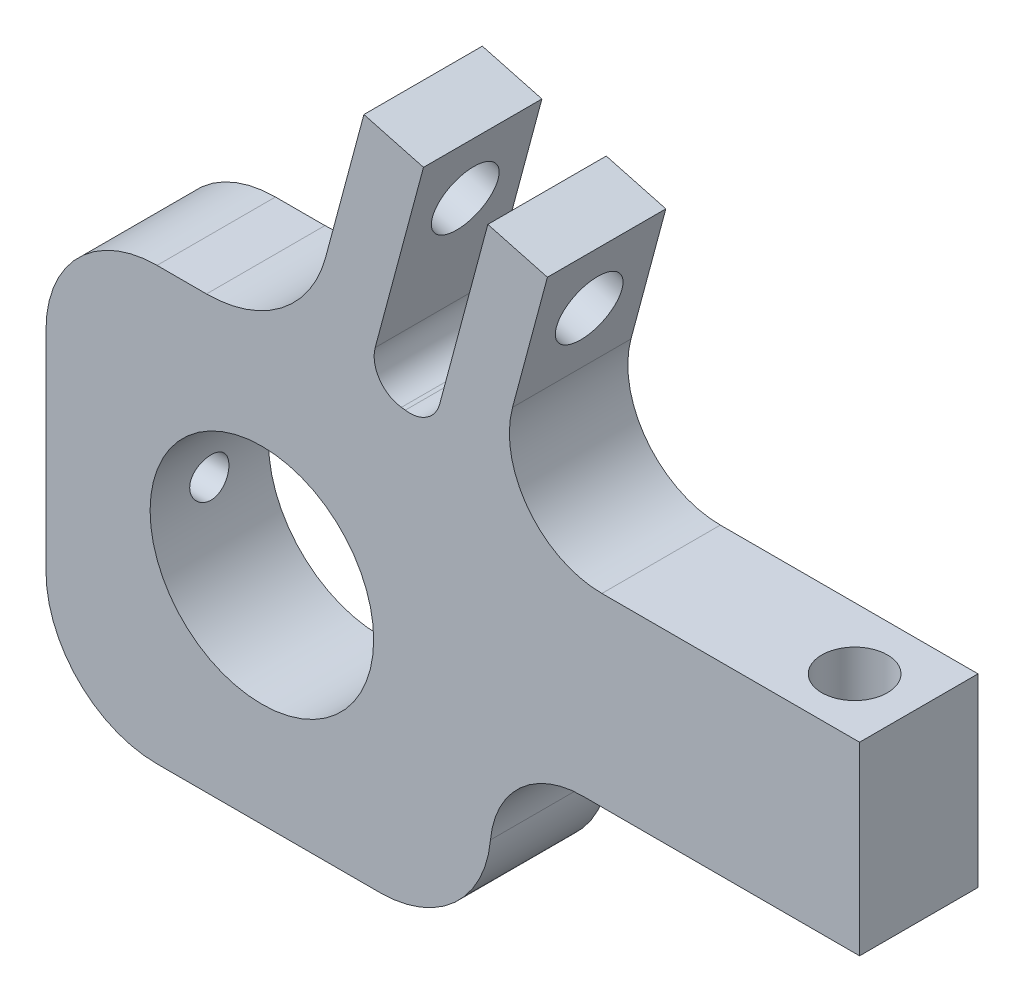
from build123d import *

# Parameters (mm, degrees)
SKETCH1_W                = 96.52
SKETCH1_H                = 44.45
BOSS_EXTRUDE1_DEPTH      = 6.096
CUT_EXTRUDE1_REACH       = 108.961
SKETCH2_R                = 11.50874
CUT_EXTRUDE2_REACH       = 108.438
SKETCH3_R                = 3.3782
CUT_EXTRUDE3_REACH       = 108.961
SKETCH7_W                = 12.7635
SKETCH7_H                = 12.192
CUT_EXTRUDE5_DEPTH       = 104.946532487
FILLET1_R                = 11.43
CUT_EXTRUDE9_REACH       = 97.016
CUT_EXTRUDE9_END_RADIUS  = 11.50874
SKETCH11_R               = 2.0193
BOSS_EXTRUDE2_DEPTH      = 6.096
FILLET2_R                = 3.175
FILLET3_R                = 12.7
FILLET4_R                = 9.525
CUT_EXTRUDE10_DEPTH      = 57.546170308
CUT_EXTRUDE10_DEPTH_BACK = 57.546170308
SKETCH15_R               = 3.3782


with BuildPart() as part:
    # Sketch1 → Boss-Extrude1 (new, symmetric)
    with BuildSketch(Plane.XY):
        with Locations((48.26, -22.225)):
            Rectangle(SKETCH1_W, SKETCH1_H)
    extrude(amount=BOSS_EXTRUDE1_DEPTH, both=True)

    # Sketch2 → Cut-Extrude1 (cut, up to next)
    with BuildSketch(Plane.XY.offset(6.096), mode=Mode.PRIVATE) as cut_extrude1_sk1:
        with Locations((22.225, -22.225)):
            Circle(SKETCH2_R)
    cut_extrude1_tool1 = extrude(cut_extrude1_sk1.sketch, amount=-CUT_EXTRUDE1_REACH, mode=Mode.PRIVATE) & part.part
    add(cut_extrude1_tool1.solids().sort_by_distance((22.225, -22.225, 6.096))[0], mode=Mode.SUBTRACT)

    # Sketch3 → Cut-Extrude2 (cut, up to next)
    with BuildSketch(Plane(origin=(0, 0, 0), x_dir=(1, 0, 0), z_dir=(0, 1, 0)), mode=Mode.PRIVATE) as cut_extrude2_sk1:
        with Locations(Location((77.4065, -0.254, 0), (0, 0, 270))):
            Circle(SKETCH3_R)
    cut_extrude2_tool1 = extrude(cut_extrude2_sk1.sketch, amount=-CUT_EXTRUDE2_REACH, mode=Mode.PRIVATE) & part.part
    add(cut_extrude2_tool1.solids().sort_by_distance((77.4065, 0, 0.254))[0], mode=Mode.SUBTRACT)

    # Sketch4 → Cut-Extrude3 (cut, up to next)
    with BuildSketch(Plane.XY.offset(6.096), mode=Mode.PRIVATE) as cut_extrude3_sk1:
        with BuildLine():
            Line((48.895, 6.35), (96.52, 6.35))
            ThreePointArc((96.52, 6.35), (102.87, 0), (96.52, -6.35))
            Line((96.52, -6.35), (48.895, -6.35))
            ThreePointArc((48.895, -6.35), (42.545, 0), (48.895, 6.35))
        make_face()
    cut_extrude3_tool1 = extrude(cut_extrude3_sk1.sketch, amount=-CUT_EXTRUDE3_REACH, mode=Mode.PRIVATE) & part.part
    # Sketch4 → Cut-Extrude3 (cut, up to next)
    with BuildSketch(Plane.XY.offset(6.096), mode=Mode.PRIVATE) as cut_extrude3_sk2:
        with BuildLine():
            Line((45.72, -34.925), (45.72, -44.45))
            Line((45.72, -44.45), (55.245, -44.45))
            Line((55.245, -44.45), (96.52, -44.45))
            ThreePointArc((96.52, -44.45), (106.045, -34.925), (96.52, -25.4))
            Line((96.52, -25.4), (55.245, -25.4))
            ThreePointArc((55.245, -25.4), (48.509807909, -28.189807909), (45.72, -34.925))
        make_face()
    cut_extrude3_tool2 = extrude(cut_extrude3_sk2.sketch, amount=-CUT_EXTRUDE3_REACH, mode=Mode.PRIVATE) & part.part
    add(cut_extrude3_tool1.solids().sort_by_distance((72.7075, 0, 6.096))[0], mode=Mode.SUBTRACT)
    add(cut_extrude3_tool2.solids().sort_by_distance((75.382091, -35.05704, 6.096))[0], mode=Mode.SUBTRACT)

    # Sketch7 → Cut-Extrude5 (cut, through all)
    with BuildSketch(Plane(origin=(0, -6.35, 0), x_dir=(1, 0, 0), z_dir=(0, 1, 0))):
        with Locations((90.13825, 0)):
            Rectangle(SKETCH7_W, SKETCH7_H)
    extrude(amount=-CUT_EXTRUDE5_DEPTH, mode=Mode.SUBTRACT)

    # Fillet1
    fillet1_edges = [part.edges().sort_by_distance(p)[0] for p in [
        (42.545, 0, 0),
        (45.72, -44.45, 0),
        (0, -44.45, 0),
        (0, 0, 0),
    ]]
    fillet(fillet1_edges, radius=FILLET1_R)

    # Cut-Extrude9: up to this cylinder (the profile starts outside it)
    cut_extrude9_end = Plane(origin=(22.225, -22.225, 0), z_dir=(0, 0, 1)) * Cylinder(CUT_EXTRUDE9_END_RADIUS, 218.04948, mode=Mode.PRIVATE)
    # Sketch11 → Cut-Extrude9 (cut, up to the surface)
    with BuildSketch(Plane.ZY, mode=Mode.PRIVATE) as cut_extrude9_sk1:
        with Locations(Location((0, -22.225, 0), (0, 0, 270))):
            Circle(SKETCH11_R)
    cut_extrude9_tool1 = extrude(cut_extrude9_sk1.sketch, amount=-CUT_EXTRUDE9_REACH, mode=Mode.PRIVATE) - cut_extrude9_end
    add(cut_extrude9_tool1.solids().sort_by_distance((0, -22.225, 0))[0], mode=Mode.SUBTRACT)

    # Sketch14 → Boss-Extrude2 (add, symmetric)
    with BuildSketch(Plane.XY):
        Polygon((45.045272578, -5.496900798), (51.619276324, 19.03761519), (45.485647327, 20.681116126), (38.911643582, -3.853399862), align=None)
        Polygon((26.270231172, 0), (32.844234917, 0), (38.86132801, 22.456097137), (32.727699014, 24.099598074), align=None)
    extrude(amount=BOSS_EXTRUDE2_DEPTH, both=True)

    # Fillet2
    fillet2_edges = [part.edges().sort_by_distance(p)[0] for p in [
        (32.844234917, 0, 0),
        (39.704874489, -0.893021814, 0),
    ]]
    fillet(fillet2_edges, radius=FILLET2_R)

    # Fillet3
    fillet3_edges = [part.edges().sort_by_distance(p)[0] for p in [
        (26.270231172, 0, 0),
    ]]
    fillet(fillet3_edges, radius=FILLET3_R)

    # Fillet4
    fillet4_edges = [part.edges().sort_by_distance(p)[0] for p in [
        (45.14505865, -5.124494109, 0),
    ]]
    fillet(fillet4_edges, radius=FILLET4_R)

    # Sketch15 → Cut-Extrude10 (cut, two sides: drawn at the far end of the back side and taken through both)
    with BuildSketch(Plane(origin=(43.402036675, -11.629540677, 0), x_dir=(0, 0, -1), z_dir=(0.9659258262890672, -0.25881904510252485, 0)).offset(-CUT_EXTRUDE10_DEPTH_BACK)):
        with Locations(Location((0, 24.80969599, 0), (0, 0, 90))):
            Circle(SKETCH15_R)
    extrude(amount=CUT_EXTRUDE10_DEPTH + CUT_EXTRUDE10_DEPTH_BACK, mode=Mode.SUBTRACT)


solid = part.part
